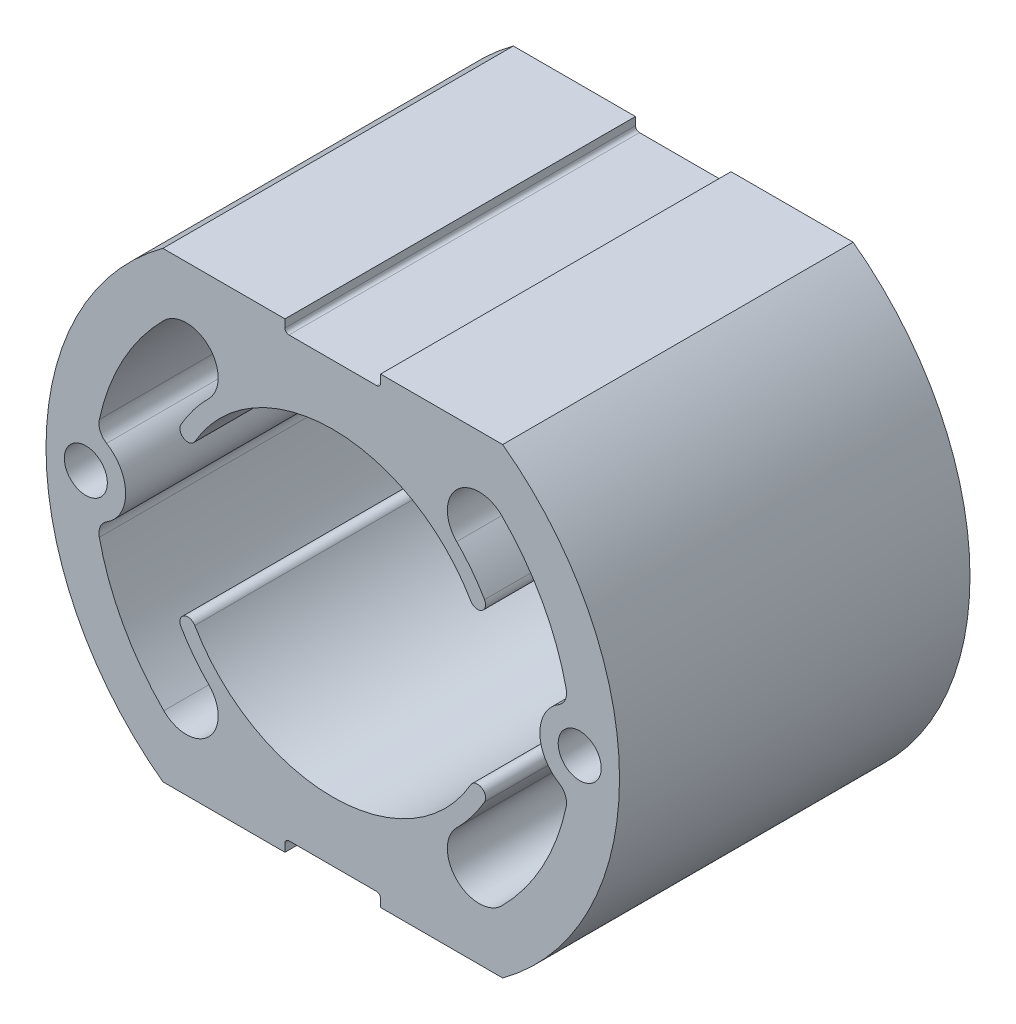
from build123d import *

# Parameters (mm, degrees)
ESQUISSE1_R      = 2.7
EXTRUSION1_DEPTH = 22


with BuildPart() as part:
    # Esquisse1 → Extrusion1 (new, symmetric)
    with BuildSketch(Plane.XY):
        with BuildLine():
            Line((-21.330729008, 29), (-6, 29))
            Line((-6, 29), (-6, 28))
            ThreePointArc((-6, 28), (-5.853553391, 27.646446609), (-5.5, 27.5))
            Line((-5.5, 27.5), (5.5, 27.5))
            ThreePointArc((5.5, 27.5), (5.853553391, 27.646446609), (6, 28))
            Line((6, 28), (6, 29))
            Line((6, 29), (21.330729008, 29))
            ThreePointArc((21.330729008, 29), (36, 0), (21.330729008, -29))
            Line((21.330729008, -29), (6, -29))
            Line((6, -29), (6, -28))
            ThreePointArc((6, -28), (5.853553391, -27.646446609), (5.5, -27.5))
            Line((5.5, -27.5), (-5.5, -27.5))
            ThreePointArc((-5.5, -27.5), (-5.853553391, -27.646446609), (-6, -28))
            Line((-6, -28), (-6, -29))
            Line((-6, -29), (-21.330729008, -29))
            ThreePointArc((-21.330729008, -29), (-36, 0), (-21.330729008, 29))
        make_face()
        with Locations((-31, 0)):
            Circle(ESQUISSE1_R, mode=Mode.SUBTRACT)
        with Locations((31, 0)):
            Circle(ESQUISSE1_R, mode=Mode.SUBTRACT)
        with BuildLine():
            ThreePointArc((-17.320508076, 10), (-18.686533479, 9.633974596), (-19.052558883, 11))
            ThreePointArc((-19.052558883, 11), (-17.453773486, 13.392751438), (-15.556349186, 15.556349186))
            ThreePointArc((-15.556349186, 15.556349186), (-15.556349186, 21.213203436), (-21.213203436, 21.213203436))
            ThreePointArc((-21.213203436, 21.213203436), (-26.32401055, 14.389109374), (-29.30875576, 6.402877149))
            ThreePointArc((-29.30875576, 6.402877149), (-29.193831331, 5.189821407), (-28.396313364, 4.268584766))
            ThreePointArc((-28.396313364, 4.268584766), (-26, 0), (-28.396313364, -4.268584766))
            ThreePointArc((-28.396313364, -4.268584766), (-29.193831331, -5.189821407), (-29.30875576, -6.402877149))
            ThreePointArc((-29.30875576, -6.402877149), (-26.32401055, -14.389109374), (-21.213203436, -21.213203436))
            ThreePointArc((-21.213203436, -21.213203436), (-15.556349186, -21.213203436), (-15.556349186, -15.556349186))
            ThreePointArc((-15.556349186, -15.556349186), (-17.453773486, -13.392751438), (-19.052558883, -11))
            ThreePointArc((-19.052558883, -11), (-18.686533479, -9.633974596), (-17.320508076, -10))
            ThreePointArc((-17.320508076, -10), (0, -20), (17.320508076, -10))
            ThreePointArc((17.320508076, -10), (18.686533479, -9.633974596), (19.052558883, -11))
            ThreePointArc((19.052558883, -11), (17.453773486, -13.392751438), (15.556349186, -15.556349186))
            ThreePointArc((15.556349186, -15.556349186), (15.556349186, -21.213203436), (21.213203436, -21.213203436))
            ThreePointArc((21.213203436, -21.213203436), (26.32401055, -14.389109374), (29.30875576, -6.402877149))
            ThreePointArc((29.30875576, -6.402877149), (29.193831331, -5.189821407), (28.396313364, -4.268584766))
            ThreePointArc((28.396313364, -4.268584766), (26, 0), (28.396313364, 4.268584766))
            ThreePointArc((28.396313364, 4.268584766), (29.193831331, 5.189821407), (29.30875576, 6.402877149))
            ThreePointArc((29.30875576, 6.402877149), (26.32401055, 14.389109374), (21.213203436, 21.213203436))
            ThreePointArc((21.213203436, 21.213203436), (15.556349186, 21.213203436), (15.556349186, 15.556349186))
            ThreePointArc((15.556349186, 15.556349186), (17.453773486, 13.392751438), (19.052558883, 11))
            ThreePointArc((19.052558883, 11), (18.686533479, 9.633974596), (17.320508076, 10))
            ThreePointArc((17.320508076, 10), (0, 20), (-17.320508076, 10))
        make_face(mode=Mode.SUBTRACT)
    extrude(amount=EXTRUSION1_DEPTH, both=True)


solid = part.part
